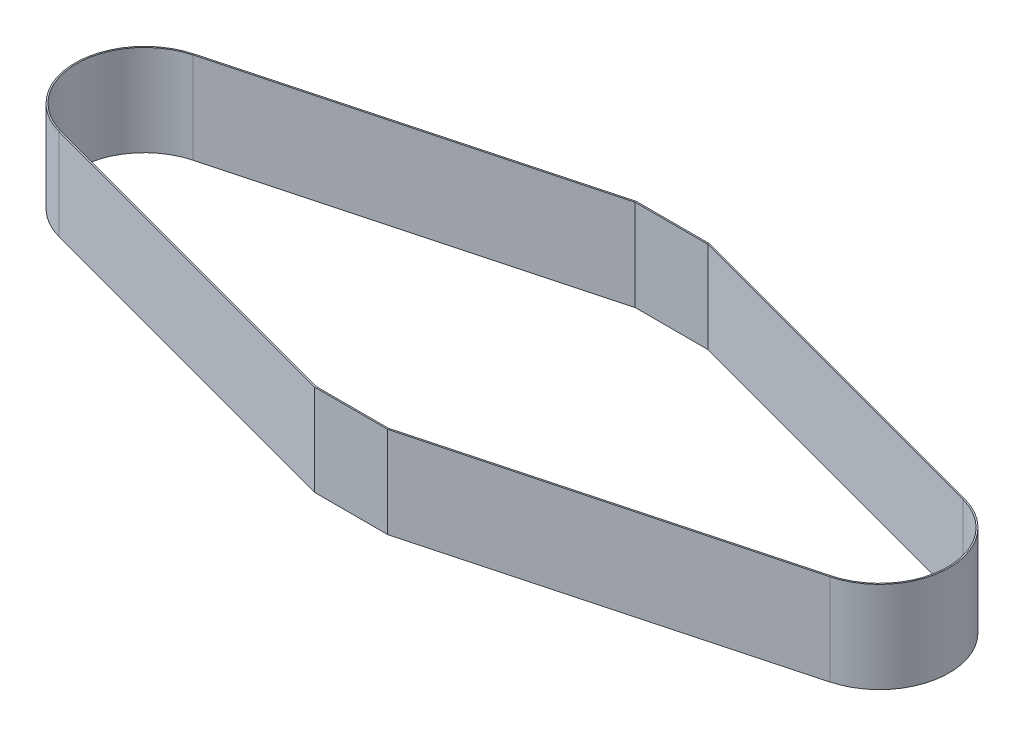
from build123d import *

# Parameters (mm, degrees)
SKETCH1_R           = 77.724
BOSS_EXTRUDE1_DEPTH = 50.8
BOSS_EXTRUDE2_START = -50.8
BOSS_EXTRUDE2_DEPTH = 101.6
BOSS_EXTRUDE3_START = -50.8
SKETCH3_R           = 77.724
BOSS_EXTRUDE3_DEPTH = 101.6
CUT_EXTRUDE2_START  = -50.8
CUT_EXTRUDE2_DEPTH  = 967.835320745
CUT_EXTRUDE4_START  = -50.8
SKETCH5_R           = 76.2
CUT_EXTRUDE4_DEPTH  = 967.835320745
CUT_EXTRUDE6_START  = -50.8
SKETCH6_R           = 76.2
CUT_EXTRUDE6_DEPTH  = 967.835320745


with BuildPart() as part:
    # Sketch1 → Boss-Extrude1 (new, symmetric)
    with BuildSketch(Plane(origin=(0, 0, 0), x_dir=(1, 0, 0), z_dir=(0, 1, 0))):
        with Locations(Location((0, 0, 0), (0, 0, 270))):
            Circle(SKETCH1_R)
    extrude(amount=BOSS_EXTRUDE1_DEPTH, both=True)

    # Sketch2 → Boss-Extrude2 (add)
    with BuildSketch(Plane(origin=(0, 0, 0), x_dir=(1, 0, 0), z_dir=(0, 1, 0)).offset(BOSS_EXTRUDE2_START)):
        Polygon((-20.116451462, -75.075618922), (368.943803327, -179.324), (450.206196673, -179.324), (839.266451462, -75.075618922), (839.266451462, 75.075618922), (450.206196673, 179.324), (368.943803327, 179.324), (-20.116451462, 75.075618922), align=None)
    extrude(amount=BOSS_EXTRUDE2_DEPTH)

    # Sketch3 → Boss-Extrude3 (add)
    with BuildSketch(Plane(origin=(0, 0, 0), x_dir=(1, 0, 0), z_dir=(0, 1, 0)).offset(BOSS_EXTRUDE3_START)):
        with Locations((819.15, 0)):
            Circle(SKETCH3_R)
    extrude(amount=BOSS_EXTRUDE3_DEPTH)

    # Sketch4 → Cut-Extrude2 (cut, through all)
    with BuildSketch(Plane(origin=(0, 0, 0), x_dir=(1, 0, 0), z_dir=(0, 1, 0)).offset(CUT_EXTRUDE2_START)):
        Polygon((-19.722011237, -73.603547963), (369.144441733, -177.8), (450.005558267, -177.8), (838.872011237, -73.603547963), (838.872011237, 73.603547963), (450.005558267, 177.8), (369.144441733, 177.8), (-19.722011237, 73.603547963), align=None)
    extrude(amount=CUT_EXTRUDE2_DEPTH, mode=Mode.SUBTRACT)

    # Sketch5 → Cut-Extrude4 (cut, through all)
    with BuildSketch(Plane(origin=(0, 0, 0), x_dir=(1, 0, 0), z_dir=(0, 1, 0)).offset(CUT_EXTRUDE4_START)):
        Circle(SKETCH5_R)
    extrude(amount=CUT_EXTRUDE4_DEPTH, mode=Mode.SUBTRACT)

    # Sketch6 → Cut-Extrude6 (cut, through all)
    with BuildSketch(Plane(origin=(0, 0, 0), x_dir=(1, 0, 0), z_dir=(0, 1, 0)).offset(CUT_EXTRUDE6_START)):
        with Locations((819.15, 0)):
            Circle(SKETCH6_R)
    extrude(amount=CUT_EXTRUDE6_DEPTH, mode=Mode.SUBTRACT)


solid = part.part
